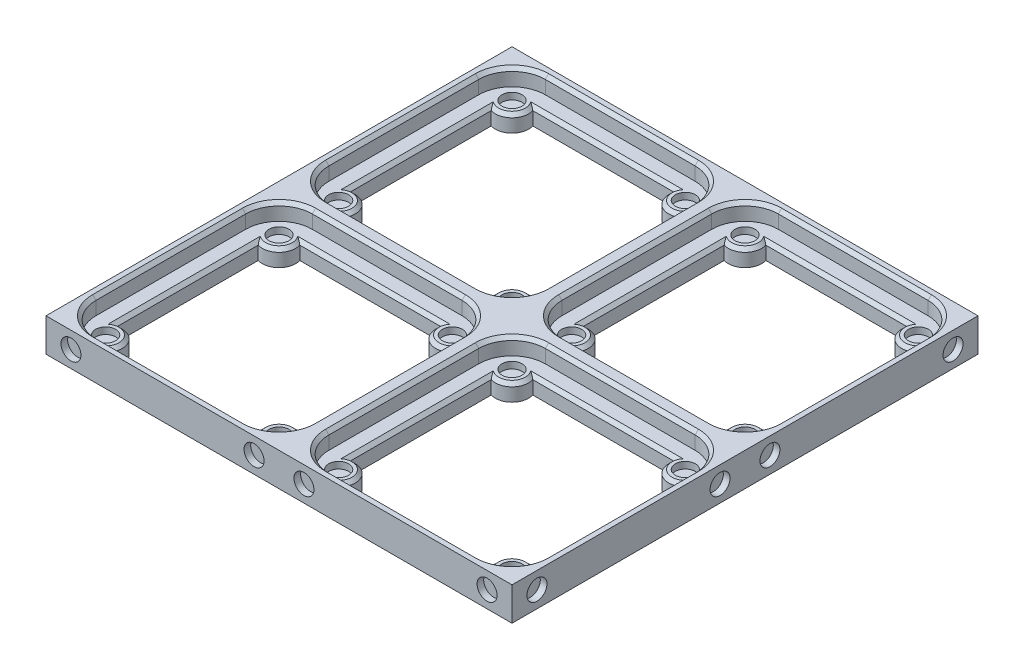
from build123d import *

# Parameters (mm, degrees)
SKETCH1_W           = 70
SKETCH1_H           = 70
BOSS_EXTRUDE2_DEPTH = 7
CUT_EXTRUDE1_DEPTH  = 5
SKETCH9_W           = 70
SKETCH9_H           = 70
BOSS_EXTRUDE3_DEPTH = 5
CUT_EXTRUDE11_DEPTH = 100.242128151
SKETCH21_R          = 3
CUT_EXTRUDE12_DEPTH = 2
CHAMFER3_SIZE       = 1
CUT_EXTRUDE13_START = -2
SKETCH22_W          = 70
SKETCH22_H          = 70
CUT_EXTRUDE13_DEPTH = 2
SKETCH27_R          = 3
CUT_EXTRUDE27_DEPTH = 2
SKETCH28_R          = 3
CUT_EXTRUDE28_DEPTH = 2


with BuildPart() as part:
    # Sketch1 → Boss-Extrude2 (new body)
    with BuildSketch(Plane(origin=(0, 0, 0), x_dir=(1, 0, 0), z_dir=(0, 1, 0))):
        with Locations((35, 35)):
            Rectangle(SKETCH1_W, SKETCH1_H)
    extrude(amount=BOSS_EXTRUDE2_DEPTH)

    # Sketch3 → Cut-Extrude1 (cut)
    with BuildSketch(Plane(origin=(0, 7, 0), x_dir=(1, 0, 0), z_dir=(0, 1, 0))):
        with BuildLine():
            Line((2.5, 57.5), (2.5, 12.5))
            ThreePointArc((2.5, 12.5), (5.428932188, 5.428932188), (12.5, 2.5))
            Line((12.5, 2.5), (57.5, 2.5))
            ThreePointArc((57.5, 2.5), (64.571067812, 5.428932188), (67.5, 12.5))
            Line((67.5, 12.5), (67.5, 57.5))
            ThreePointArc((67.5, 57.5), (64.571067812, 64.571067812), (57.5, 67.5))
            Line((57.5, 67.5), (12.5, 67.5))
            ThreePointArc((12.5, 67.5), (5.428932188, 64.571067812), (2.5, 57.5))
        make_face()
    extrude(amount=-CUT_EXTRUDE1_DEPTH, mode=Mode.SUBTRACT)

    # Sketch9 → Boss-Extrude3 (add)
    with BuildSketch(Plane.XZ):
        with Locations((35, -35)):
            Rectangle(SKETCH9_W, SKETCH9_H)
    extrude(amount=BOSS_EXTRUDE3_DEPTH)

    # Sketch20 → Cut-Extrude11 (cut, through all)
    with BuildSketch(Plane(origin=(0, 2, 0), x_dir=(1, 0, 0), z_dir=(0, 1, 0))):
        with BuildLine():
            Line((13.745191882, 7.5), (56.254808118, 7.5))
            ThreePointArc((56.254808118, 7.5), (57.5, 12.5), (62.5, 13.745191882))
            Line((62.5, 13.745191882), (62.5, 56.254808118))
            ThreePointArc((62.5, 56.254808118), (57.5, 57.5), (56.254808118, 62.5))
            Line((56.254808118, 62.5), (13.745191882, 62.5))
            ThreePointArc((13.745191882, 62.5), (12.5, 57.5), (7.5, 56.254808118))
            Line((7.5, 56.254808118), (7.5, 13.745191882))
            ThreePointArc((7.5, 13.745191882), (12.5, 12.5), (13.745191882, 7.5))
        make_face()
    extrude(amount=-CUT_EXTRUDE11_DEPTH, mode=Mode.SUBTRACT)

    # Sketch21 → Cut-Extrude12 (cut)
    with BuildSketch(Plane(origin=(0, 2, 0), x_dir=(1, 0, 0), z_dir=(0, 1, 0))):
        with Locations(Location((8.964466094, 61.035533906, 0), (0, 0, 270))):
            Circle(SKETCH21_R)
        with Locations(Location((61.035533906, 61.035533906, 0), (0, 0, 270))):
            Circle(SKETCH21_R)
        with Locations(Location((61.035533906, 8.964466094, 0), (0, 0, 270))):
            Circle(SKETCH21_R)
        with Locations(Location((8.964466094, 8.964466094, 0), (0, 0, 270))):
            Circle(SKETCH21_R)
    extrude(amount=-CUT_EXTRUDE12_DEPTH, mode=Mode.SUBTRACT)

    # Chamfer3
    chamfer3_edges = [part.edges().sort_by_distance(p)[0] for p in [
        (5.428932188, 7, -5.428932188),
        (35, 7, -2.5),
        (64.571067812, 7, -5.428932188),
        (67.5, 7, -35),
        (64.571067812, 7, -64.571067812),
        (35, 7, -67.5),
        (5.428932188, 7, -64.571067812),
        (2.5, 7, -35),
        (12.5, 2, -12.5),
        (12.5, 2, -57.5),
        (57.5, 2, -57.5),
        (57.5, 2, -12.5),
        (35, 2, -7.5),
        (62.5, 2, -35),
        (35, 2, -62.5),
        (7.5, 2, -35),
    ]]
    chamfer(chamfer3_edges, length=CHAMFER3_SIZE)

    # Sketch22 → Cut-Extrude13 (cut)
    with BuildSketch(Plane.XZ.offset(5).offset(CUT_EXTRUDE13_START)):
        with Locations((35, -35)):
            Rectangle(SKETCH22_W, SKETCH22_H)
        with BuildLine():
            Line((7.5, -13.745191882), (7.5, -56.254808118))
            ThreePointArc((7.5, -56.254808118), (12.5, -57.5), (13.745191882, -62.5))
            Line((13.745191882, -62.5), (56.254808118, -62.5))
            ThreePointArc((56.254808118, -62.5), (57.5, -57.5), (62.5, -56.254808118))
            Line((62.5, -56.254808118), (62.5, -13.745191882))
            ThreePointArc((62.5, -13.745191882), (57.5, -12.5), (56.254808118, -7.5))
            Line((56.254808118, -7.5), (13.745191882, -7.5))
            ThreePointArc((13.745191882, -7.5), (12.5, -12.5), (7.5, -13.745191882))
        make_face(mode=Mode.SUBTRACT)
    extrude(amount=CUT_EXTRUDE13_DEPTH, mode=Mode.SUBTRACT)

    # Sketch27 → Cut-Extrude27 (cut)
    with BuildSketch(Plane.ZY):
        with Locations((-62.5, 2)):
            Circle(SKETCH27_R)
        with Locations((-7.5, 2)):
            Circle(SKETCH27_R)
    extrude(amount=-CUT_EXTRUDE27_DEPTH, mode=Mode.SUBTRACT)

    # Sketch28 → Cut-Extrude28 (cut)
    with BuildSketch(Plane.XY):
        with Locations((7.5, 2)):
            Circle(SKETCH28_R)
        with Locations((62.5, 2)):
            Circle(SKETCH28_R)
    extrude(amount=-CUT_EXTRUDE28_DEPTH, mode=Mode.SUBTRACT)

    # Mirror2: part across plane


with BuildPart() as part_1:
    add(part.part)
    add(part.part.mirror(Plane(origin=(0, 7, -70), x_dir=(1, 0, 0), z_dir=(0, 0, 1))))

    # Mirror3: part across plane


with BuildPart() as part_2:
    add(part_1.part)
    add(part_1.part.mirror(Plane(origin=(70, 7, 0), x_dir=(0, 0, 1), z_dir=(-1, 0, 0))))


solid = part_2.part
